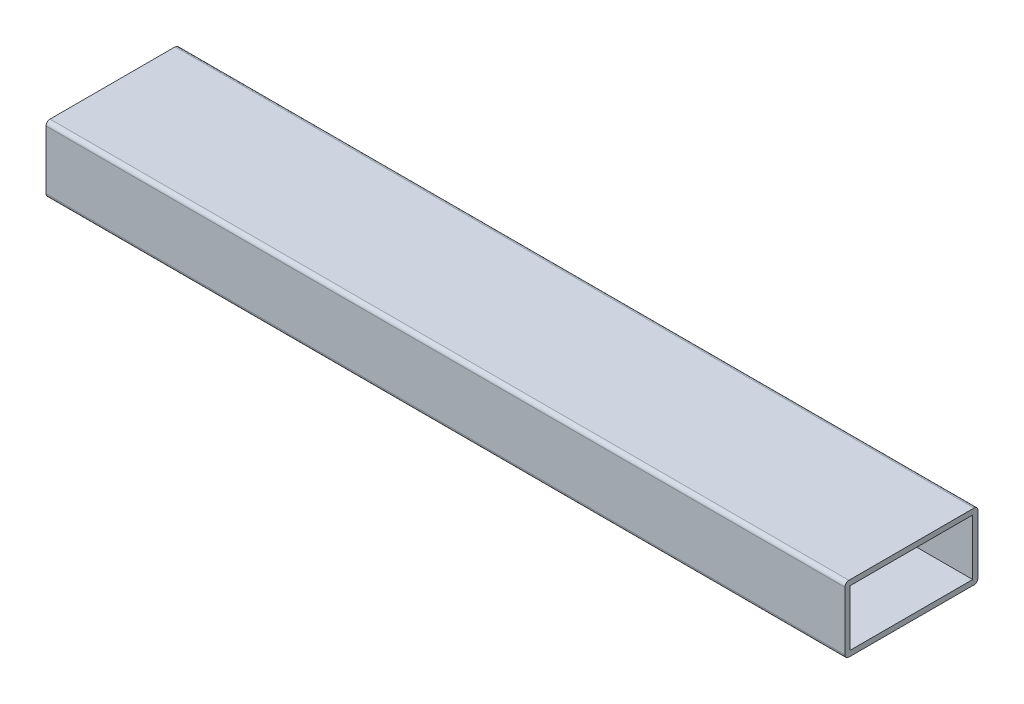
from build123d import *

# Parameters (mm, degrees)
BOSS_EXTRUDE1_DEPTH = 150
SHELL1_T            = -2


with BuildPart() as part:
    # Sketch1 → Boss-Extrude1 (new, symmetric)
    with BuildSketch(Plane(origin=(0, 0, 0), x_dir=(0, 0, -1), z_dir=(1, 0, 0))):
        with BuildLine():
            Line((-23.5, 12.5), (23.5, 12.5))
            ThreePointArc((23.5, 12.5), (24.560660172, 12.060660172), (25, 11))
            Line((25, 11), (25, -11))
            ThreePointArc((25, -11), (24.560660172, -12.060660172), (23.5, -12.5))
            Line((23.5, -12.5), (-23.5, -12.5))
            ThreePointArc((-23.5, -12.5), (-24.560660172, -12.060660172), (-25, -11))
            Line((-25, -11), (-25, 11))
            ThreePointArc((-25, 11), (-24.560660172, 12.060660172), (-23.5, 12.5))
        make_face()
    extrude(amount=BOSS_EXTRUDE1_DEPTH, both=True)

    # Shell1
    shell1_openings = [part.faces().sort_by_distance(p)[0] for p in [
        (150, 0, 0),
        (-150, 0, 0),
    ]]
    offset(amount=SHELL1_T, openings=shell1_openings, kind=Kind.INTERSECTION)


solid = part.part
